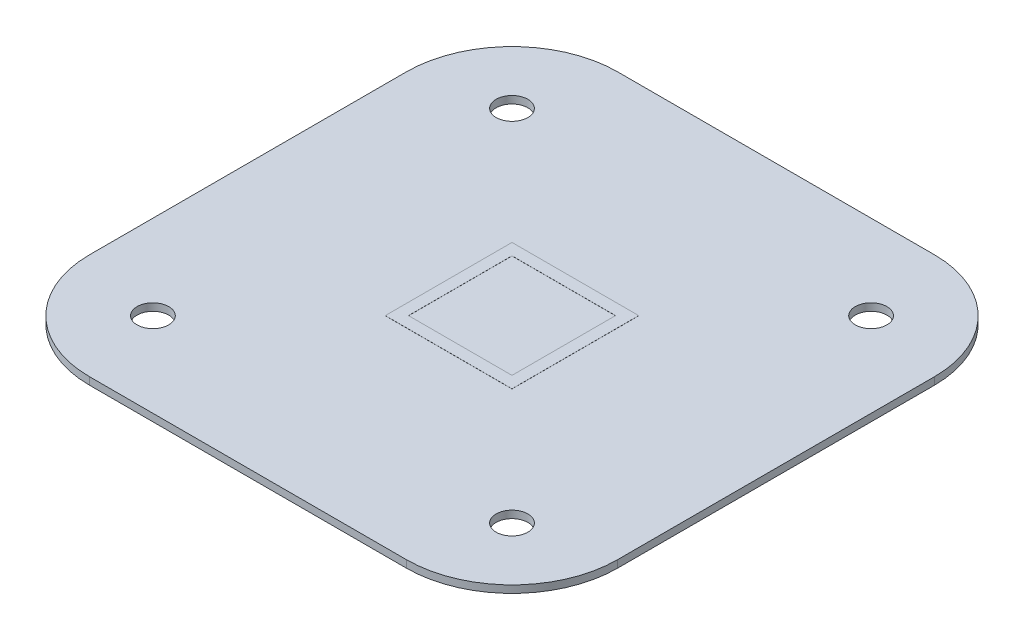
from build123d import *

# Parameters (mm, degrees)
SKETCH1_W           = 50
SKETCH1_H           = 50
SKETCH1_R           = 1.5
BOSS_EXTRUDE1_DEPTH = 0.7
FILLET1_R           = 10
SKETCH2_W           = 12
SKETCH2_H           = 12
SKETCH2_W_2         = 9.8
SKETCH2_H_2         = 9.8
BOSS_EXTRUDE2_DEPTH = 0.01


with BuildPart() as part:
    # Sketch1 → Boss-Extrude1 (new body)
    with BuildSketch(Plane(origin=(0, 0, 0), x_dir=(1, 0, 0), z_dir=(0, 1, 0))):
        Rectangle(SKETCH1_W, SKETCH1_H)
        with Locations(Location((-17, 17, 0), (0, 0, 270))):
            Circle(SKETCH1_R, mode=Mode.SUBTRACT)
        with Locations(Location((17, 17, 0), (0, 0, 270))):
            Circle(SKETCH1_R, mode=Mode.SUBTRACT)
        with Locations(Location((17, -17, 0), (0, 0, 270))):
            Circle(SKETCH1_R, mode=Mode.SUBTRACT)
        with Locations(Location((-17, -17, 0), (0, 0, 270))):
            Circle(SKETCH1_R, mode=Mode.SUBTRACT)
    extrude(amount=BOSS_EXTRUDE1_DEPTH)

    # Fillet1
    fillet1_edges = [part.edges().sort_by_distance(p)[0] for p in [
        (-25, 0.35, -25),
        (25, 0.35, -25),
        (25, 0.35, 25),
        (-25, 0.35, 25),
    ]]
    fillet(fillet1_edges, radius=FILLET1_R)

    # Sketch2 → Boss-Extrude2 (add)
    with BuildSketch(Plane(origin=(0, 0.7, 0), x_dir=(1, 0, 0), z_dir=(0, 1, 0))):
        Rectangle(SKETCH2_W, SKETCH2_H)
        Rectangle(SKETCH2_W_2, SKETCH2_H_2, mode=Mode.SUBTRACT)
    extrude(amount=BOSS_EXTRUDE2_DEPTH)


solid = part.part
